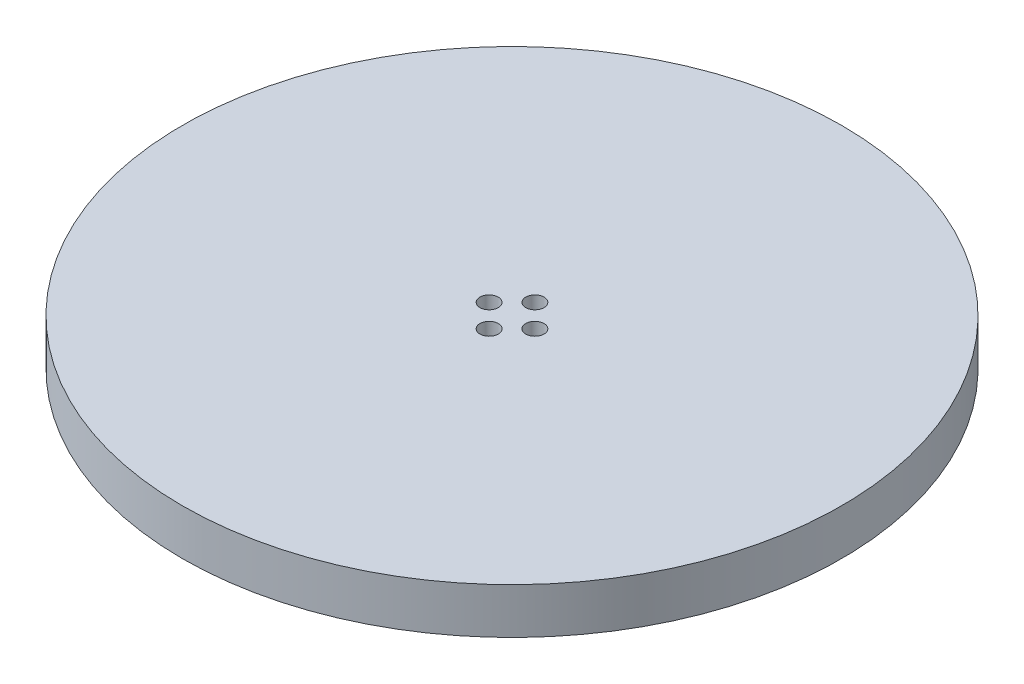
from build123d import *

# Parameters (mm, degrees)
SKETCH_6_R      = 72
SKETCH_6_R_2    = 2
EXTRUDE_2_DEPTH = 10


with BuildPart() as part:
    # 草圖6 → 填料-伸長2 (new body)
    with BuildSketch(Plane(origin=(0, 0, 0), x_dir=(1, 0, 0), z_dir=(0, 1, 0))):
        Circle(SKETCH_6_R)
        with Locations((0, -5)):
            Circle(SKETCH_6_R_2, mode=Mode.SUBTRACT)
        with Locations((-5, 0)):
            Circle(SKETCH_6_R_2, mode=Mode.SUBTRACT)
        with Locations((5, 0)):
            Circle(SKETCH_6_R_2, mode=Mode.SUBTRACT)
        with Locations((0, 5)):
            Circle(SKETCH_6_R_2, mode=Mode.SUBTRACT)
    extrude(amount=EXTRUDE_2_DEPTH)


solid = part.part
